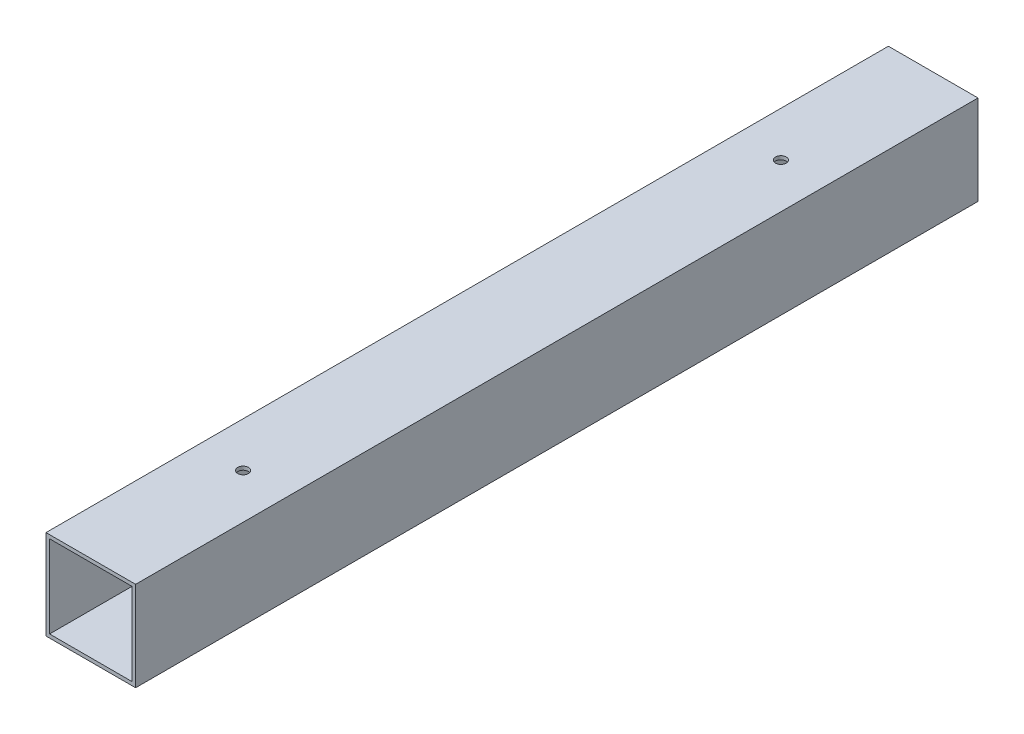
from build123d import *

# Parameters (mm, degrees)
SKETCH1_W               = 25
SKETCH1_H               = 25
SKETCH1_W_2             = 23
SKETCH1_H_2             = 23
BOSS_EXTRUDE1_DEPTH     = 117.5
CUT_EXTRUDE1_DEPTH      = 121.778723292
CUT_EXTRUDE1_DEPTH_BACK = 121.778723292
SKETCH2_R               = 1.5


with BuildPart() as part:
    # Sketch1 → Boss-Extrude1 (new, symmetric)
    with BuildSketch(Plane.XY):
        Rectangle(SKETCH1_W, SKETCH1_H)
        Rectangle(SKETCH1_W_2, SKETCH1_H_2, mode=Mode.SUBTRACT)
    extrude(amount=BOSS_EXTRUDE1_DEPTH, both=True)

    # Sketch2 → Cut-Extrude1 (cut, two sides: drawn at the far end of the back side and taken through both)
    with BuildSketch(Plane(origin=(0, 12.5, 0), x_dir=(1, 0, 0), z_dir=(0, 1, 0)).offset(-CUT_EXTRUDE1_DEPTH_BACK)):
        with Locations(Location((0, 75, 0), (0, 0, 270))):
            Circle(SKETCH2_R)
        with Locations(Location((0, -75, 0), (0, 0, 270))):
            Circle(SKETCH2_R)
    extrude(amount=CUT_EXTRUDE1_DEPTH + CUT_EXTRUDE1_DEPTH_BACK, mode=Mode.SUBTRACT)


solid = part.part
